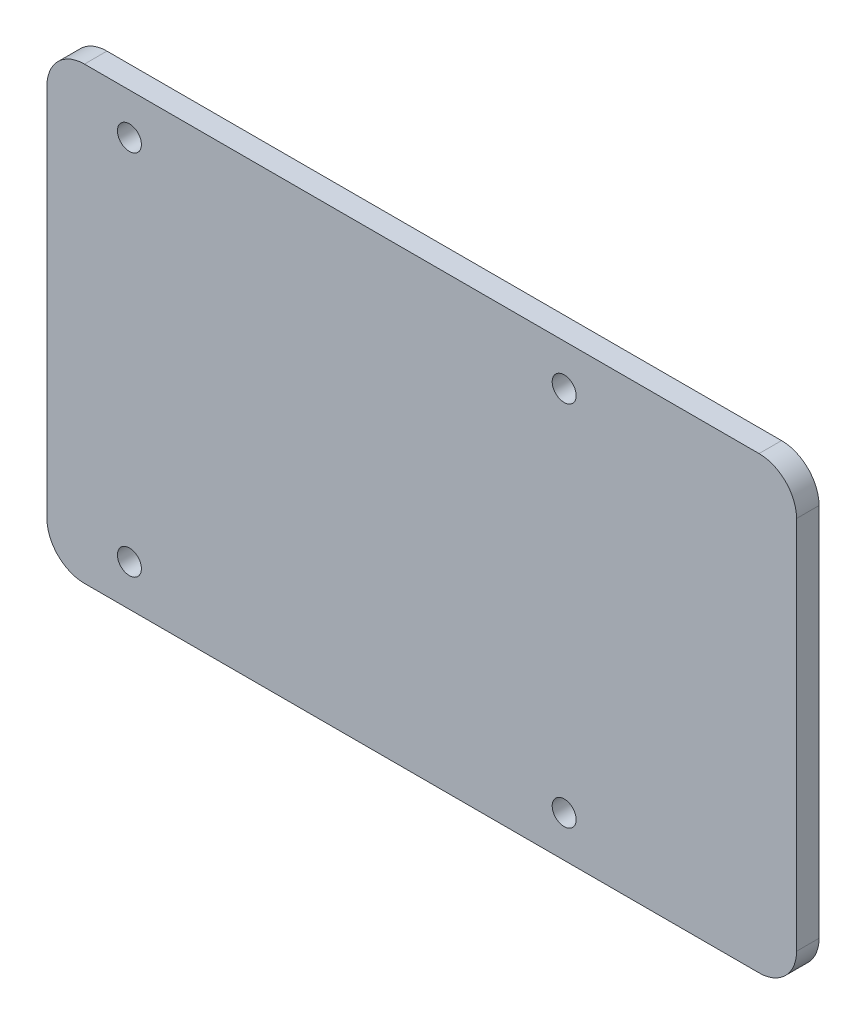
from build123d import *

# Parameters (mm, degrees)
SKETCH_1_R      = 1.6
EXTRUDE_1_DEPTH = 3


with BuildPart() as part:
    # 草图1 → 凸台-拉伸1 (new body)
    with BuildSketch(Plane.XY):
        with BuildLine():
            Line((-45, 30), (45, 30))
            ThreePointArc((45, 30), (48.535533906, 28.535533906), (50, 25))
            Line((50, 25), (50, -25))
            ThreePointArc((50, -25), (48.535533906, -28.535533906), (45, -30))
            Line((45, -30), (-45, -30))
            ThreePointArc((-45, -30), (-48.535533906, -28.535533906), (-50, -25))
            Line((-50, -25), (-50, 25))
            ThreePointArc((-50, 25), (-48.535533906, 28.535533906), (-45, 30))
        make_face()
        with Locations((-39, 24.5)):
            Circle(SKETCH_1_R, mode=Mode.SUBTRACT)
        with Locations((19, 24.5)):
            Circle(SKETCH_1_R, mode=Mode.SUBTRACT)
        with Locations((19, -24.5)):
            Circle(SKETCH_1_R, mode=Mode.SUBTRACT)
        with Locations((-39, -24.5)):
            Circle(SKETCH_1_R, mode=Mode.SUBTRACT)
    extrude(amount=EXTRUDE_1_DEPTH)


solid = part.part
